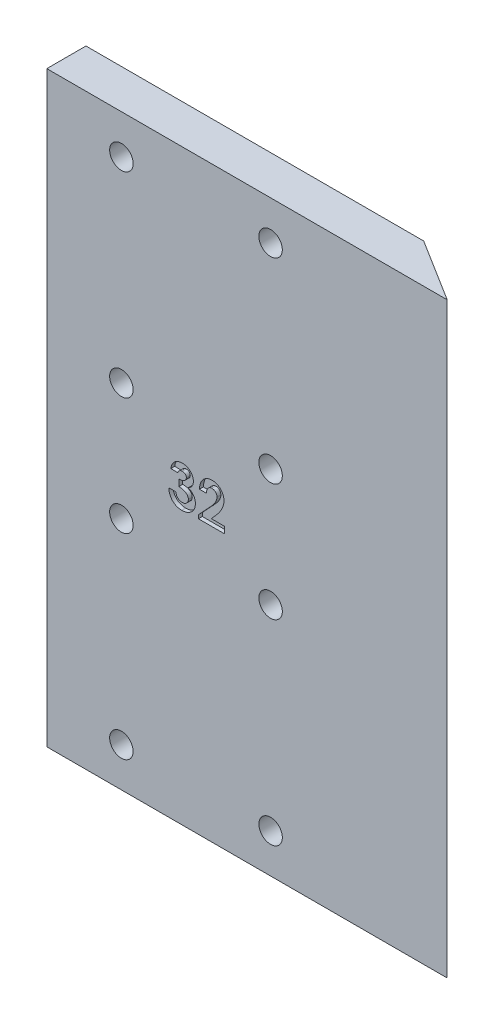
from build123d import *

# Parameters (mm, degrees)
SKETCH1_R           = 3
BOSS_EXTRUDE1_DEPTH = 10
BOSS_EXTRUDE2_DEPTH = 150
CUT_EXTRUDE1_DEPTH  = 1


with BuildPart() as part:
    # Sketch1 → Boss-Extrude1 (new body)
    with BuildSketch(Plane.XY):
        Polygon((-38.1, -75), (-38.1, 75), (0, 75), (38.1, 75), (38.1, -75), (0, -75), align=None)
        with Locations((-19.05, 65)):
            Circle(SKETCH1_R, mode=Mode.SUBTRACT)
        with Locations((-19.05, 15)):
            Circle(SKETCH1_R, mode=Mode.SUBTRACT)
        with Locations(Location((19.05, 15, 0), (0, 0, 180))):
            Circle(SKETCH1_R, mode=Mode.SUBTRACT)
        with Locations(Location((19.05, 65, 0), (0, 0, 180))):
            Circle(SKETCH1_R, mode=Mode.SUBTRACT)
        with Locations((19.05, -65)):
            Circle(SKETCH1_R, mode=Mode.SUBTRACT)
        with Locations((19.05, -15)):
            Circle(SKETCH1_R, mode=Mode.SUBTRACT)
        with Locations(Location((-19.05, -15, 0), (0, 0, 180))):
            Circle(SKETCH1_R, mode=Mode.SUBTRACT)
        with Locations(Location((-19.05, -65, 0), (0, 0, 180))):
            Circle(SKETCH1_R, mode=Mode.SUBTRACT)
    extrude(amount=BOSS_EXTRUDE1_DEPTH)

    # Sketch2 → Boss-Extrude2 (add)
    with BuildSketch(Plane.XZ.offset(75)):
        Polygon((48.164487892, 0), (64.152657177, 10), (38.1, 10), (38.1, 0), align=None)
    extrude(amount=-BOSS_EXTRUDE2_DEPTH)

    # Sketch3 → Cut-Extrude1 (cut)
    with BuildSketch(Plane.XY.offset(10)):
        with BuildLine():
            Line((-4.643408281, 2.36330082), (-6.438280076, 2.36330082))
            add(Edge.make_bspline(
                [(-6.438280076, 2.36330082), (-6.425607599, 2.453020058), (-6.400764046, 2.62890868), (-6.341316747, 2.88355159), (-6.270211362, 3.125097817), (-6.181439922, 3.352782433), (-6.077325466, 3.567011021), (-5.958926719, 3.768518709), (-5.824963748, 3.956440587), (-5.722279712, 4.069645472), (-5.671052512, 4.126121332)],
                knots=[0, 0, 0, 0, 1.111473889, 2.178970933, 3.205615836, 4.199322666, 5.174200091, 6.12565194, 7.064921805, 8, 8, 8, 8], degree=3))
            add(Edge.make_bspline(
                [(-5.671052512, 4.126121332), (-5.597164064, 4.200637138), (-5.451537698, 4.34749996), (-5.20817896, 4.535615013), (-4.953094061, 4.698415798), (-4.681167159, 4.827485437), (-4.396629644, 4.931952358), (-4.097218774, 5.002123025), (-3.784158049, 5.048681882), (-3.570533489, 5.053268091), (-3.461517256, 5.055608512)],
                knots=[0, 0, 0, 0, 1.01925491, 2.00884431, 2.983262333, 3.955970413, 4.92937149, 5.924503185, 6.940838805, 8, 8, 8, 8], degree=3))
            add(Edge.make_bspline(
                [(-3.461517256, 5.055608512), (-3.364596215, 5.053320396), (-3.174068979, 5.048822421), (-2.894041883, 5.012715121), (-2.627059481, 4.949386938), (-2.370299692, 4.86658676), (-2.127538616, 4.753923279), (-1.893418279, 4.623144957), (-1.674480013, 4.46273991), (-1.470211544, 4.28149835), (-1.282551996, 4.085467861), (-1.120038005, 3.875927389), (-0.980321811, 3.658474243), (-0.865214147, 3.4313018), (-0.776711996, 3.194025656), (-0.715288878, 2.948016523), (-0.675085956, 2.693817239), (-0.671080695, 2.52104141), (-0.669049307, 2.433412999)],
                knots=[0, 0, 0, 0, 1.091422571, 2.145516843, 3.172569842, 4.178562979, 5.178154469, 6.181868002, 7.194278174, 8.227918432, 9.254613415, 10.245994977, 11.209837596, 12.161663635, 13.10878368, 14.055455738, 15.013766427, 16, 16, 16, 16], degree=3))
            add(Edge.make_bspline(
                [(-0.669049307, 2.433412999), (-0.673217836, 2.324892509), (-0.681424388, 2.111249029), (-0.748765089, 1.798565922), (-0.854171598, 1.499585072), (-1.006441552, 1.218489669), (-1.196817778, 0.956044698), (-1.430403031, 0.721024482), (-1.700544197, 0.509744223), (-1.903342768, 0.396202186), (-2.007190332, 0.338060435)],
                knots=[0, 0, 0, 0, 0.992805628, 1.954529043, 2.915727527, 3.886831945, 4.871318353, 5.87440735, 6.911542536, 8, 8, 8, 8], degree=3))
            add(Edge.make_bspline(
                [(-2.007190332, 0.338060435), (-1.935910958, 0.314657915), (-1.795850183, 0.268673014), (-1.596770632, 0.178106271), (-1.407468728, 0.079131833), (-1.231204181, -0.035850373), (-1.066223827, -0.162190977), (-0.913533406, -0.300969984), (-0.772220628, -0.451884791), (-0.644592366, -0.615765372), (-0.531317298, -0.789990776), (-0.42968161, -0.9705365), (-0.346029774, -1.160140551), (-0.275166255, -1.356637524), (-0.221214805, -1.561793431), (-0.183228164, -1.774813308), (-0.161270953, -1.995211245), (-0.157922104, -2.144530713), (-0.156228794, -2.220032514)],
                knots=[0, 0, 0, 0, 1.059543567, 2.081955587, 3.086750234, 4.076226789, 5.052108497, 6.020845489, 6.989030705, 7.970690546, 8.952259656, 9.923888338, 10.895517021, 11.877585046, 12.873342345, 13.889638361, 14.932918083, 16, 16, 16, 16], degree=3))
            add(Edge.make_bspline(
                [(-0.156228794, -2.220032514), (-0.159661361, -2.330989506), (-0.166429683, -2.549774098), (-0.209459511, -2.872021412), (-0.289573297, -3.179255596), (-0.394967421, -3.475011842), (-0.535551743, -3.755472046), (-0.700995856, -4.027072386), (-0.904359911, -4.280393836), (-1.13036414, -4.522133561), (-1.381355012, -4.741912494), (-1.653469949, -4.932450939), (-1.940725378, -5.095966827), (-2.244938681, -5.228713682), (-2.566004169, -5.330943944), (-2.903206215, -5.404840689), (-3.257961648, -5.45005194), (-3.500109987, -5.454791483), (-3.623776871, -5.457212001)],
                knots=[0, 0, 0, 0, 1.005138573, 1.981928558, 2.936866704, 3.876260664, 4.820238198, 5.773547, 6.751179199, 7.756627054, 8.768222608, 9.766606018, 10.760583154, 11.757261445, 12.767156078, 13.807575856, 14.880313354, 16, 16, 16, 16], degree=3))
            add(Edge.make_bspline(
                [(-3.623776871, -5.457212001), (-3.740763748, -5.454659974), (-3.969516107, -5.449669822), (-4.304114307, -5.406477533), (-4.622118224, -5.336804866), (-4.924339408, -5.238595464), (-5.209608593, -5.111234652), (-5.480512708, -4.959576503), (-5.731645921, -4.774873726), (-5.965806353, -4.565464154), (-6.177799616, -4.330518505), (-6.367271671, -4.075479177), (-6.530044624, -3.79937636), (-6.66678601, -3.503389682), (-6.77642682, -3.186999892), (-6.86291117, -2.850850385), (-6.923321903, -2.49428443), (-6.941720119, -2.248959466), (-6.951100589, -2.123878668)],
                knots=[0, 0, 0, 0, 1.066544725, 2.085487077, 3.070979577, 4.031932826, 4.977951092, 5.916076795, 6.857635327, 7.814973522, 8.776389752, 9.738577119, 10.707772778, 11.69409279, 12.707140348, 13.757286496, 14.856535458, 16, 16, 16, 16], degree=3))
            Line((-6.951100589, -2.123878668), (-5.156228794, -2.123878668))
            add(Edge.make_bspline(
                [(-5.156228794, -2.123878668), (-5.144854879, -2.186770935), (-5.122701196, -2.30927012), (-5.079491796, -2.486621707), (-5.023183919, -2.650328176), (-4.958078004, -2.801844545), (-4.887753815, -2.943160171), (-4.802785377, -3.06905592), (-4.709398731, -3.182950377), (-4.574641121, -3.318349363), (-4.381995835, -3.457466168), (-4.121860877, -3.57836529), (-3.832485371, -3.649227029), (-3.630183032, -3.657871943), (-3.52561982, -3.662340206)],
                knots=[0, 0, 0, 0, 0.928156231, 1.807827665, 2.648129825, 3.438902246, 4.202261636, 4.936546065, 5.639352463, 6.338805438, 7.70633318, 9.064371875, 10.482673459, 12, 12, 12, 12], degree=3))
            add(Edge.make_bspline(
                [(-3.52561982, -3.662340206), (-3.470134883, -3.661388731), (-3.361452305, -3.659525006), (-3.201813782, -3.638868102), (-3.049735611, -3.604846166), (-2.904934538, -3.558611616), (-2.766488753, -3.500653717), (-2.637043399, -3.425920474), (-2.513960058, -3.339032411), (-2.398576756, -3.241347162), (-2.291960208, -3.134905209), (-2.203248969, -3.01703883), (-2.122173316, -2.897265522), (-2.062209179, -2.767749294), (-2.009667677, -2.635459502), (-1.977509593, -2.495594441), (-1.953227931, -2.351088105), (-1.951816778, -2.252194312), (-1.951100589, -2.202003668)],
                knots=[0, 0, 0, 0, 1.110435564, 2.175094844, 3.216326037, 4.226890168, 5.215276772, 6.21526065, 7.213097102, 8.228249917, 9.239874822, 10.221364777, 11.178138315, 12.128914389, 13.072518965, 14.022636769, 14.996447288, 16, 16, 16, 16], degree=3))
            add(Edge.make_bspline(
                [(-1.951100589, -2.202003668), (-1.953001937, -2.147111647), (-1.956787086, -2.037834212), (-1.987712147, -1.878366774), (-2.036549356, -1.72497195), (-2.104390204, -1.578329046), (-2.194984095, -1.438978558), (-2.301883877, -1.304124694), (-2.433511483, -1.180786356), (-2.577924595, -1.058870146), (-2.745387073, -0.952595981), (-2.927743258, -0.854520542), (-3.129785754, -0.776482771), (-3.346582523, -0.706780587), (-3.58223448, -0.655871195), (-3.835278312, -0.618906014), (-4.105305823, -0.591391166), (-4.291439295, -0.587443707), (-4.386998025, -0.585417129)],
                knots=[0, 0, 0, 0, 0.809814727, 1.612155564, 2.388397, 3.182215007, 3.988903953, 4.837162975, 5.715530372, 6.646997145, 7.623086902, 8.637258368, 9.698941581, 10.815059213, 11.996518529, 13.252603015, 14.589518788, 16, 16, 16, 16], degree=3))
            Line((-4.386998025, -0.585417129), (-4.386998025, 1.081249538))
            add(Edge.make_bspline(
                [(-4.386998025, 1.081249538), (-4.268021723, 1.09138194), (-4.045440624, 1.110337659), (-3.736486125, 1.154666265), (-3.476386262, 1.213918747), (-3.258889532, 1.285403659), (-3.078294183, 1.377208909), (-2.920527083, 1.478557851), (-2.784650594, 1.596259836), (-2.669816734, 1.726805006), (-2.577953218, 1.866998278), (-2.512937574, 2.014660631), (-2.470004639, 2.165223212), (-2.465936747, 2.268203478), (-2.463921102, 2.319230307)],
                knots=[0, 0, 0, 0, 1.70044513, 3.18119609, 4.440695891, 5.496282586, 6.431922213, 7.318171381, 8.16090191, 8.983045123, 9.787564368, 10.536848927, 11.275007137, 12, 12, 12, 12], degree=3))
            add(Edge.make_bspline(
                [(-2.463921102, 2.319230307), (-2.467398666, 2.384334999), (-2.474186135, 2.511405576), (-2.526901299, 2.693270339), (-2.61840885, 2.855387702), (-2.741104407, 2.997416524), (-2.89061321, 3.11604964), (-3.065863737, 3.202175261), (-3.26305304, 3.252777908), (-3.40178634, 3.258023697), (-3.473536486, 3.260736717)],
                knots=[0, 0, 0, 0, 1.009664648, 1.970651636, 2.907870547, 3.878035693, 4.867062054, 5.849714035, 6.887914197, 8, 8, 8, 8], degree=3))
            add(Edge.make_bspline(
                [(-3.473536486, 3.260736717), (-3.538569927, 3.257535639), (-3.667616192, 3.25118372), (-3.856320457, 3.20377468), (-4.035526638, 3.123967462), (-4.201523883, 3.01391801), (-4.351915987, 2.881753284), (-4.475344513, 2.725231599), (-4.57800651, 2.553730441), (-4.621522227, 2.427026205), (-4.643408281, 2.36330082)],
                knots=[0, 0, 0, 0, 0.98818071, 1.960853194, 2.938124878, 3.957524365, 4.978590984, 5.968022688, 6.978025184, 8, 8, 8, 8], degree=3))
        make_face()
        with BuildLine():
            Line((2.664284026, 1.465864922), (0.869412232, 1.465864922))
            add(Edge.make_bspline(
                [(0.869412232, 1.465864922), (0.877164008, 1.601637478), (0.892310513, 1.8669289), (0.952559481, 2.252273185), (1.033291031, 2.61638116), (1.141038001, 2.957979136), (1.276429119, 3.276942987), (1.435980424, 3.574360079), (1.623768087, 3.848664503), (1.83579537, 4.098533408), (2.068462633, 4.32269311), (2.316939475, 4.521447183), (2.585026684, 4.685454042), (2.867826088, 4.820416504), (3.165289532, 4.928245239), (3.480231486, 5.000337474), (3.809925014, 5.049159042), (4.035626932, 5.053431125), (4.150662232, 5.055608512)],
                knots=[0, 0, 0, 0, 1.199038563, 2.342849363, 3.436047546, 4.486744587, 5.497670872, 6.488682221, 7.459191391, 8.424610317, 9.374430501, 10.305433194, 11.225809216, 12.140057399, 13.06607119, 14.010487599, 14.985989317, 16, 16, 16, 16], degree=3))
            add(Edge.make_bspline(
                [(4.150662232, 5.055608512), (4.29186643, 5.051202569), (4.567530117, 5.042601135), (4.968091319, 4.969228051), (5.342171686, 4.846500229), (5.689499296, 4.675017095), (6.007117288, 4.457165749), (6.294972993, 4.197413673), (6.544361196, 3.890311133), (6.75686309, 3.548636163), (6.933426766, 3.186850456), (7.057155236, 2.812749033), (7.138480627, 2.436259028), (7.147154484, 2.182749714), (7.151463514, 2.056810435)],
                knots=[0, 0, 0, 0, 1.075374347, 2.099382735, 3.09057751, 4.06680945, 5.040638231, 6.016817125, 7.011024321, 8.044445721, 9.0776792, 10.070479129, 11.0414456, 12, 12, 12, 12], degree=3))
            add(Edge.make_bspline(
                [(7.151463514, 2.056810435), (7.149785805, 1.980633458), (7.146408992, 1.82730802), (7.122929561, 1.595289001), (7.087705775, 1.358950503), (7.034596891, 1.118495166), (6.968365758, 0.873855585), (6.88801782, 0.624299638), (6.791689329, 0.371242216), (6.68098781, 0.111835202), (6.548920618, -0.154763598), (6.395146731, -0.432550605), (6.21558464, -0.721279398), (6.01240323, -1.022580234), (5.784615697, -1.335977916), (5.531110058, -1.660528392), (5.254806101, -1.997375274), (5.058705411, -2.222538511), (4.957953898, -2.338221616)],
                knots=[0, 0, 0, 0, 0.728284026, 1.46585585, 2.227944881, 3.01186502, 3.81876927, 4.650621989, 5.517437689, 6.406905708, 7.346299482, 8.360816762, 9.441613733, 10.596154504, 11.834900912, 13.145207542, 14.533280747, 16, 16, 16, 16], degree=3))
            Line((4.957953898, -2.338221616), (3.914284026, -3.534135078))
            Line((3.914284026, -3.534135078), (7.279668642, -3.534135078))
            Line((7.279668642, -3.534135078), (7.279668642, -5.200801744))
            Line((7.279668642, -5.200801744), (0.613001975, -5.200801744))
            Line((0.613001975, -5.200801744), (0.613001975, -4.291346616))
            Line((0.613001975, -4.291346616), (3.573739155, -1.14030495))
            add(Edge.make_bspline(
                [(3.573739155, -1.14030495), (3.659460104, -1.048388086), (3.825476163, -0.870372379), (4.061699906, -0.608937374), (4.275461526, -0.360841796), (4.462328503, -0.123443925), (4.632107375, 0.095556016), (4.777227716, 0.30275896), (4.899017262, 0.496291718), (5.031237088, 0.729658423), (5.156802459, 1.007989746), (5.272016286, 1.328638843), (5.342247087, 1.635105532), (5.351941159, 1.834805815), (5.356591719, 1.930608512)],
                knots=[0, 0, 0, 0, 1.246127091, 2.413378631, 3.493388633, 4.492180848, 5.408488754, 6.240484944, 6.999099869, 7.674939598, 8.898438119, 10.020720584, 11.050475521, 12, 12, 12, 12], degree=3))
            add(Edge.make_bspline(
                [(5.356591719, 1.930608512), (5.353114607, 2.02329023), (5.346377146, 2.202875919), (5.272337908, 2.458335606), (5.157633753, 2.689628274), (4.995999398, 2.889842638), (4.800209571, 3.054372057), (4.573956035, 3.176744417), (4.319083421, 3.247352707), (4.140412863, 3.256190343), (4.04849877, 3.260736717)],
                knots=[0, 0, 0, 0, 1.062038974, 2.057870785, 3.028805853, 4.01125022, 4.991535629, 5.949134679, 6.94496649, 8, 8, 8, 8], degree=3))
            add(Edge.make_bspline(
                [(4.04849877, 3.260736717), (4.001014779, 3.259057232), (3.907534916, 3.255750896), (3.770126825, 3.23374151), (3.639373154, 3.194952265), (3.513818543, 3.142980136), (3.394802942, 3.074090706), (3.282626548, 2.989173508), (3.17610744, 2.890386482), (3.075734157, 2.77803852), (2.984381367, 2.652658161), (2.903242152, 2.5153905), (2.83615353, 2.366320741), (2.777086268, 2.207416833), (2.731530769, 2.036972019), (2.698360715, 1.856006392), (2.673143737, 1.664814359), (2.667290988, 1.533387815), (2.664284026, 1.465864922)],
                knots=[0, 0, 0, 0, 0.903469896, 1.778625579, 2.63899355, 3.493148037, 4.358286772, 5.247621495, 6.164656832, 7.118446693, 8.109501108, 9.111810964, 10.146451449, 11.215617525, 12.33435995, 13.498009769, 14.714554818, 16, 16, 16, 16], degree=3))
        make_face()
    extrude(amount=-CUT_EXTRUDE1_DEPTH, mode=Mode.SUBTRACT)


solid = part.part
